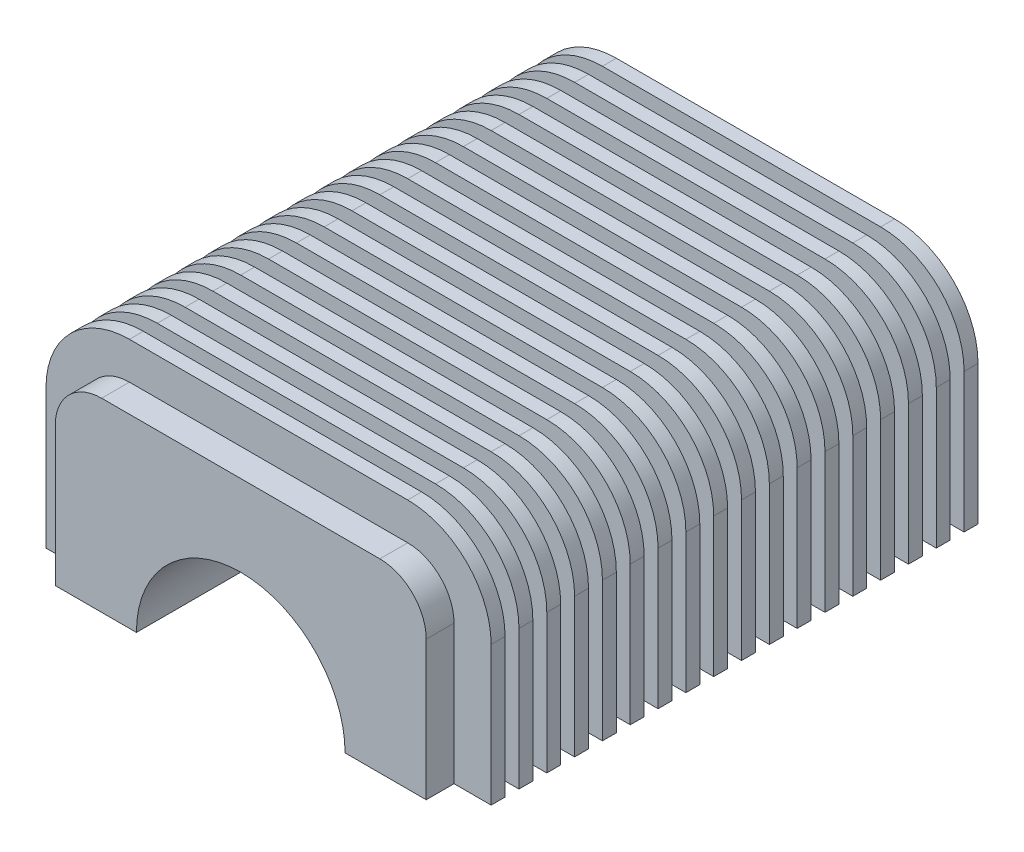
from build123d import *

# Parameters (mm, degrees)
DODANIE_WYCI_GNI_CIE1_DEPTH = 108
ZAOKR_GLENIE1_R             = 10
DODANIE_WYCI_GNI_CIE2_DEPTH = 3
SZYK_LINIOWY1_COUNT         = 18
SZYK_LINIOWY1_PITCH         = 6


with BuildPart() as part:
    # Szkic1 → Dodanie-wyciągnięcie1 (new body)
    with BuildSketch(Plane.XY):
        with BuildLine():
            Line((-22.5, 0), (-40, 0))
            Line((-40, 0), (-40, 40))
            Line((-40, 40), (40, 40))
            Line((40, 40), (40, 0))
            Line((40, 0), (22.5, 0))
            ThreePointArc((22.5, 0), (0, 22.5), (-22.5, 0))
        make_face()
    extrude(amount=DODANIE_WYCI_GNI_CIE1_DEPTH)

    # Zaokrąglenie1
    zaokr_glenie1_edges = [part.edges().sort_by_distance(p)[0] for p in [
        (-40, 40, 54),
        (40, 40, 54),
    ]]
    fillet(zaokr_glenie1_edges, radius=ZAOKR_GLENIE1_R)


with BuildPart() as body_2:
    # Szkic3 → Dodanie-wyciągnięcie2 (new body)
    with BuildSketch(Plane(origin=(0, 0, 0), x_dir=(-1, 0, 0), z_dir=(0, 0, -1))):
        with BuildLine():
            Line((48, 0), (48, 30))
            ThreePointArc((48, 30), (42.727922061, 42.727922061), (30, 48))
            Line((30, 48), (-30, 48))
            ThreePointArc((-30, 48), (-42.727922061, 42.727922061), (-48, 30))
            Line((-48, 30), (-48, 0))
            Line((-48, 0), (-40, 0))
            Line((-40, 0), (-40, 30))
            ThreePointArc((-40, 30), (-37.071067812, 37.071067812), (-30, 40))
            Line((-30, 40), (30, 40))
            ThreePointArc((30, 40), (37.071067812, 37.071067812), (40, 30))
            Line((40, 30), (40, 0))
            Line((40, 0), (48, 0))
        make_face()
    dodanie_wyci_gni_cie2 = extrude(amount=DODANIE_WYCI_GNI_CIE2_DEPTH)


with BuildPart() as szyk_liniowy1_1:
    # Szyk liniowy1: Dodanie-wyciągnięcie2 ×18
    with Locations(*[(0, 0, i * SZYK_LINIOWY1_PITCH) for i in range(1, SZYK_LINIOWY1_COUNT)]):
        add(dodanie_wyci_gni_cie2)


solid = Compound([part.part, body_2.part, szyk_liniowy1_1.part])
